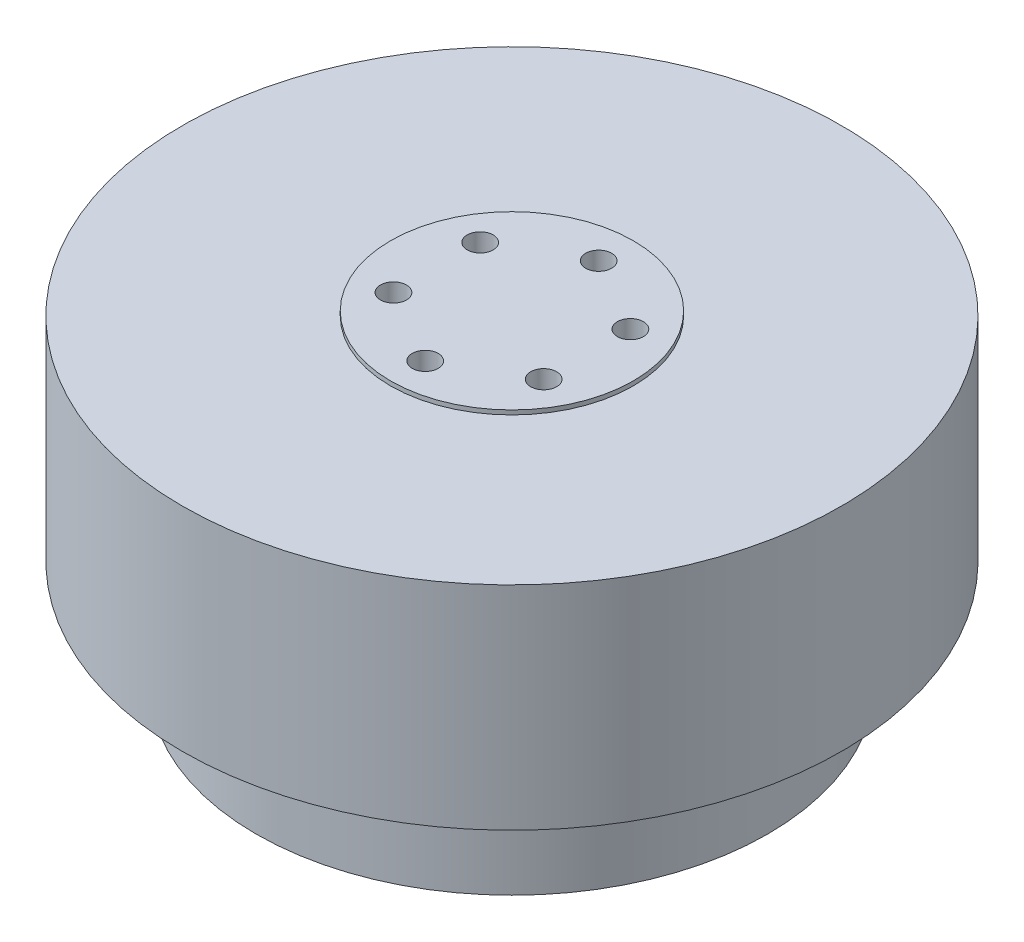
from build123d import *

# Parameters (mm, degrees)
SKETCH1_R           = 38
BOSS_EXTRUDE1_DEPTH = 24.5
SKETCH2_R           = 14
BOSS_EXTRUDE2_DEPTH = 0.5
SKETCH3_R           = 29.5
BOSS_EXTRUDE3_DEPTH = 12.5
SKETCH4_R           = 1.5
CUT_EXTRUDE1_DEPTH  = 5
SKETCH8_R           = 1.5
CUT_EXTRUDE3_DEPTH  = 3


with BuildPart() as part:
    # Sketch1 → Boss-Extrude1 (new body)
    with BuildSketch(Plane(origin=(0, 0, 0), x_dir=(1, 0, 0), z_dir=(0, 1, 0))):
        with Locations(Location((0, 0, 0), (0, 0, 270))):
            Circle(SKETCH1_R)
    extrude(amount=BOSS_EXTRUDE1_DEPTH)

    # Sketch2 → Boss-Extrude2 (add)
    with BuildSketch(Plane(origin=(0, 24.5, 0), x_dir=(1, 0, 0), z_dir=(0, 1, 0))):
        with Locations(Location((0, 0, 0), (0, 0, 270))):
            Circle(SKETCH2_R)
    extrude(amount=BOSS_EXTRUDE2_DEPTH)

    # Sketch3 → Boss-Extrude3 (add)
    with BuildSketch(Plane.XZ):
        with Locations(Location((0, 0, 0), (0, 0, 270))):
            Circle(SKETCH3_R)
    extrude(amount=BOSS_EXTRUDE3_DEPTH)

    # Sketch4 → Cut-Extrude1 (cut)
    with BuildSketch(Plane(origin=(0, 25, 0), x_dir=(1, 0, 0), z_dir=(0, 1, 0))):
        with Locations(Location((0, 10, 0), (0, 0, 270))):
            Circle(SKETCH4_R)
        with Locations(Location((8.660254038, 5, 0), (0, 0, 270))):
            Circle(SKETCH4_R)
        with Locations(Location((8.660254038, -5, 0), (0, 0, 270))):
            Circle(SKETCH4_R)
        with Locations(Location((0, -10, 0), (0, 0, 270))):
            Circle(SKETCH4_R)
        with Locations(Location((-8.660254038, -5, 0), (0, 0, 270))):
            Circle(SKETCH4_R)
        with Locations(Location((-8.660254038, 5, 0), (0, 0, 270))):
            Circle(SKETCH4_R)
    extrude(amount=-CUT_EXTRUDE1_DEPTH, mode=Mode.SUBTRACT)

    # Sketch8 → Cut-Extrude3 (cut)
    with BuildSketch(Plane.XZ):
        with Locations(Location((0, 34, 0), (0, 0, 270))):
            Circle(SKETCH8_R)
        with Locations(Location((29.444863729, 17, 0), (0, 0, 270))):
            Circle(SKETCH8_R)
        with Locations(Location((29.444863729, -17, 0), (0, 0, 270))):
            Circle(SKETCH8_R)
        with Locations(Location((0, -34, 0), (0, 0, 270))):
            Circle(SKETCH8_R)
        with Locations(Location((-29.444863729, -17, 0), (0, 0, 270))):
            Circle(SKETCH8_R)
        with Locations(Location((-29.444863729, 17, 0), (0, 0, 270))):
            Circle(SKETCH8_R)
    extrude(amount=-CUT_EXTRUDE3_DEPTH, mode=Mode.SUBTRACT)


solid = part.part
